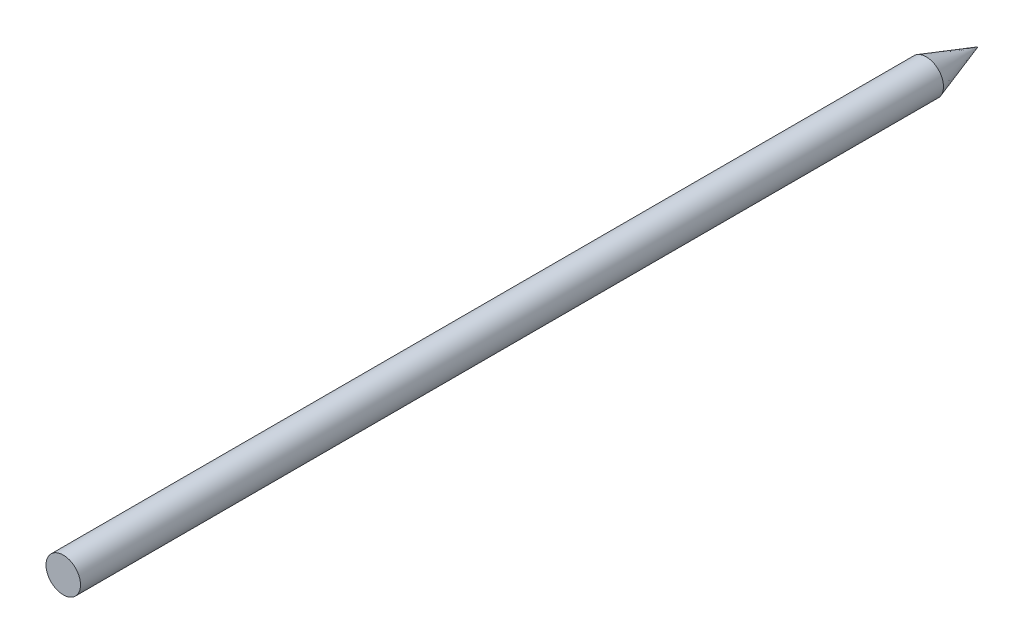
from build123d import *


with BuildPart() as part:
    # Sketch2 → Revolve2 (revolve)
    with BuildSketch(Plane(origin=(0, 0, 0), x_dir=(1, 0, 0), z_dir=(0, 1, 0))):
        Polygon((0, 0), (2.54, 0), (2.54, 127), (0, 134.62), align=None)
    revolve(axis=Axis((0, 0, -134.62), (0, 0, 1)))


solid = part.part
